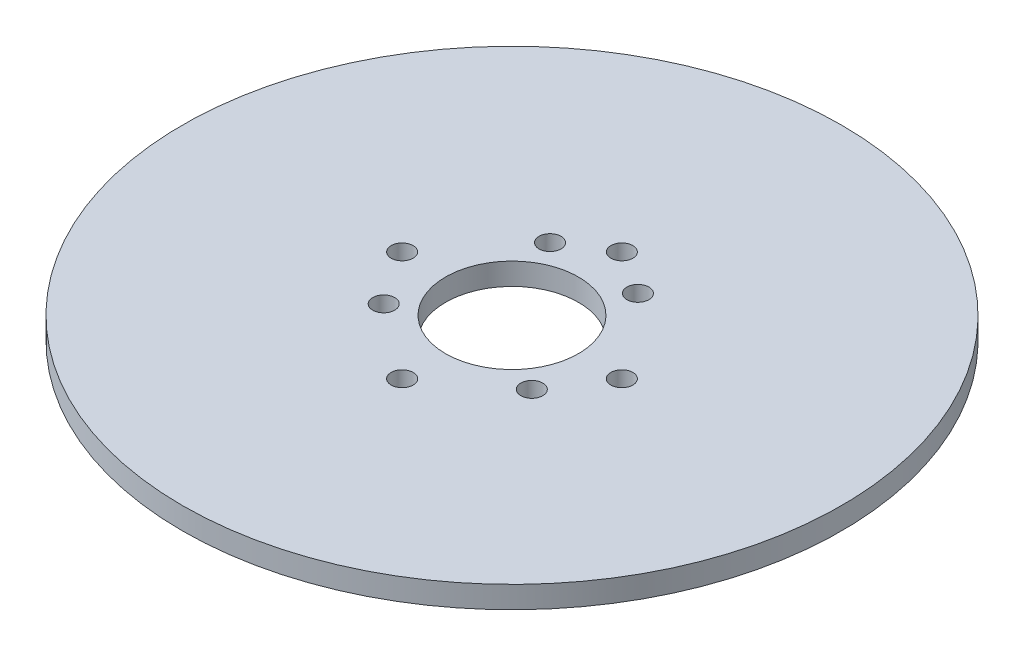
from build123d import *

# Parameters (mm, degrees)
SKETCH1_R           = 150
SKETCH1_R_2         = 5
SKETCH1_R_3         = 30.25
BOSS_EXTRUDE1_DEPTH = 10


with BuildPart() as part:
    # Sketch1 → Boss-Extrude1 (new body)
    with BuildSketch(Plane(origin=(0, 0, 0), x_dir=(1, 0, 0), z_dir=(0, 1, 0))):
        with Locations(Location((0, 3, 0), (0, 0, 270))):
            Circle(SKETCH1_R)
        with Locations(Location((-20, 40.311288741, 0), (0, 0, 270))):
            Circle(SKETCH1_R_2, mode=Mode.SUBTRACT)
        with Locations(Location((20, 40.311288741, 0), (0, 0, 270))):
            Circle(SKETCH1_R_2, mode=Mode.SUBTRACT)
        with Locations(Location((33.7, -21.693227223, 0), (0, 0, 270))):
            Circle(SKETCH1_R_2, mode=Mode.SUBTRACT)
        with Locations(Location((-33.7, -21.693227223, 0), (0, 0, 270))):
            Circle(SKETCH1_R_2, mode=Mode.SUBTRACT)
        with Locations(Location((0, 3, 0), (0, 0, 270))):
            Circle(SKETCH1_R_3, mode=Mode.SUBTRACT)
        with Locations(Location((0, 53, 0), (0, 0, 270))):
            Circle(SKETCH1_R_2, mode=Mode.SUBTRACT)
        with Locations(Location((50, 3, 0), (0, 0, 270))):
            Circle(SKETCH1_R_2, mode=Mode.SUBTRACT)
        with Locations(Location((0, -47, 0), (0, 0, 270))):
            Circle(SKETCH1_R_2, mode=Mode.SUBTRACT)
        with Locations(Location((-50, 3, 0), (0, 0, 270))):
            Circle(SKETCH1_R_2, mode=Mode.SUBTRACT)
    extrude(amount=BOSS_EXTRUDE1_DEPTH)


solid = part.part
